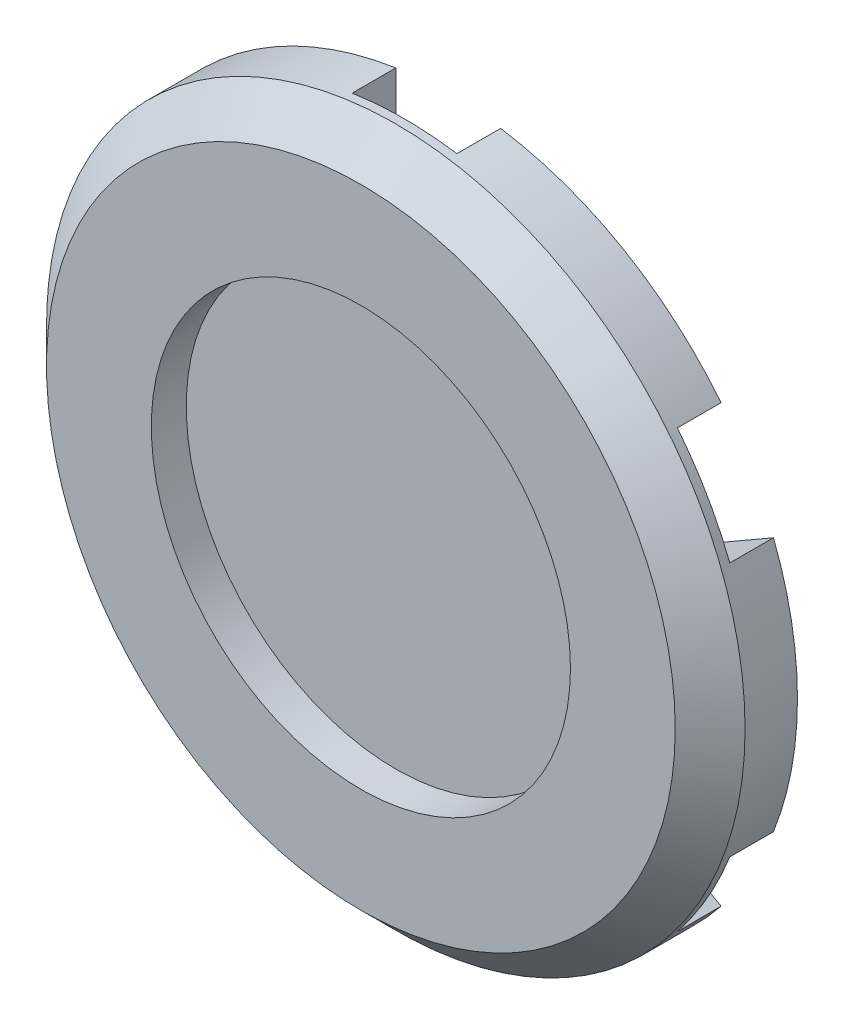
from build123d import *

# Parameters (mm, degrees)
SKETCH1_R           = 100
SKETCH1_R_2         = 60
BOSS_EXTRUDE1_DEPTH = 25
CUT_EXTRUDE1_START  = 25
SKETCH1_3_R         = 60
CUT_EXTRUDE1_DEPTH  = 10
CHAMFER1_SIZE       = 10
CUT_EXTRUDE2_DEPTH  = 12.5
CIRPATTERN1_COUNT   = 6


with BuildPart() as part:
    # Sketch1 → Boss-Extrude1 (new body)
    # profile 1 of 2: a face of its own
    with BuildSketch(Plane(origin=(0, 0, 0), x_dir=(0, 1, 0), z_dir=(0, 0, 1))):
        with Locations(Location((0, 0, 0), (0, 0, 270))):
            Circle(SKETCH1_R)
        Circle(SKETCH1_R_2, mode=Mode.SUBTRACT)
    # profile 2 of 2: a face of its own
    with BuildSketch(Plane(origin=(0, 0, 0), x_dir=(0, 1, 0), z_dir=(0, 0, 1))):
        Circle(SKETCH1_R_2)
    extrude(amount=BOSS_EXTRUDE1_DEPTH)

    # Sketch1<3> → Cut-Extrude1 (cut)
    with BuildSketch(Plane(origin=(0, 0, 0), x_dir=(0, 1, 0), z_dir=(0, 0, 1)).offset(CUT_EXTRUDE1_START)):
        with Locations(Location((0, 0, 0), (0, 0, 270))):
            Circle(SKETCH1_3_R)
    extrude(amount=-CUT_EXTRUDE1_DEPTH, mode=Mode.SUBTRACT)

    # Chamfer1
    chamfer1_edges = [part.edges().sort_by_distance(p)[0] for p in [
        (-100, 0, 25),
    ]]
    chamfer(chamfer1_edges, length=CHAMFER1_SIZE)

    # Sketch3 → Cut-Extrude2 (cut)
    with BuildSketch(Plane(origin=(0, 0, 0), x_dir=(1, 0, 0), z_dir=(0, 0, -1))):
        with BuildLine():
            Line((-15, 98.868599666), (-15, 68.868599666))
            Line((-15, 68.868599666), (15, 68.868599666))
            Line((15, 68.868599666), (15, 98.868599666))
            ThreePointArc((15, 98.868599666), (0, 100), (-15, 98.868599666))
        make_face()
    cut_extrude2 = extrude(amount=-CUT_EXTRUDE2_DEPTH, mode=Mode.SUBTRACT)

    # CirPattern1: Cut-Extrude2 ×6 about axis
    cirpattern1_axis = Axis((0, 0, 0), (0, 0, 1))
    for i in range(1, CIRPATTERN1_COUNT):
        add(cut_extrude2.rotate(cirpattern1_axis, i * 360 / CIRPATTERN1_COUNT), mode=Mode.SUBTRACT)


solid = part.part
